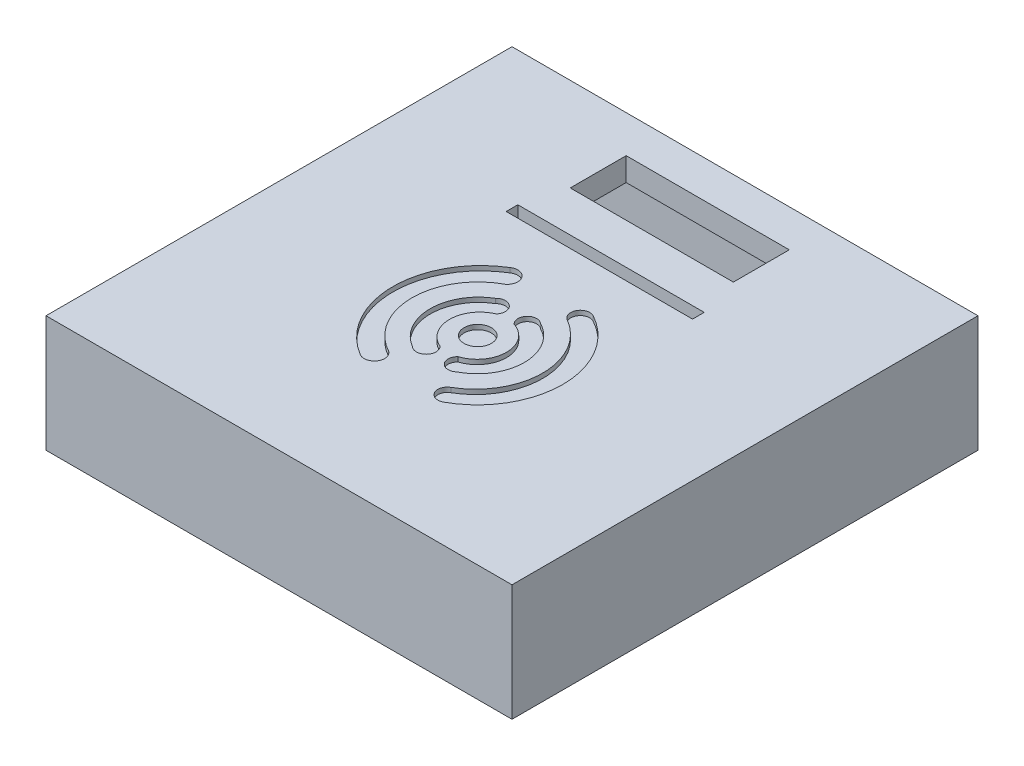
from build123d import *

# Parameters (mm, degrees)
ESQUISSE1_W              = 200
ESQUISSE1_H              = 200
BOSS_EXTRU_1_DEPTH       = 50
ESQUISSE2_W              = 190
ESQUISSE2_H              = 190
ENL_V_MAT_EXTRU_1_DEPTH  = 40
ESQUISSE3_W              = 70
ESQUISSE3_H              = 24
ENL_V_MAT_EXTRU_2_DEPTH  = 10
ESQUISSE5_W              = 5
ESQUISSE5_H              = 18
ESQUISSE5_W_2            = 30
ESQUISSE5_H_2            = 14
ENL_V_MAT_EXTRU_3_DEPTH  = 6
ESQUISSE7_W              = 5
ESQUISSE7_H              = 14
ENL_V_MAT_EXTRU_5_DEPTH  = 6
ESQUISSE8_W              = 80
ESQUISSE8_H              = 5
ENL_V_MAT_EXTRU_6_DEPTH  = 10
ESQUISSE9_W              = 190
ESQUISSE9_H              = 5
BOSS_EXTRU_2_DEPTH       = 75
ESQUISSE11_W             = 50
ESQUISSE11_H             = 40
ESQUISSE11_W_2           = 40
ESQUISSE11_H_2           = 30
ENL_V_MAT_EXTRU_9_DEPTH  = 6
ESQUISSE12_R             = 5.86708194
ENL_V_MAT_EXTRU_10_DEPTH = 2
ESQUISSE13_W             = 20
ESQUISSE13_H             = 10
ENL_V_MAT_EXTRU_11_DEPTH = 5


with BuildPart() as part:
    # Esquisse1 → Boss.-Extru.1 (new body)
    with BuildSketch(Plane(origin=(0, 0, 0), x_dir=(1, 0, 0), z_dir=(0, 1, 0))):
        Rectangle(ESQUISSE1_W, ESQUISSE1_H)
    extrude(amount=BOSS_EXTRU_1_DEPTH)

    # Esquisse2 → Enlèv. mat.-Extru.1 (cut)
    with BuildSketch(Plane.XZ):
        Rectangle(ESQUISSE2_W, ESQUISSE2_H)
    extrude(amount=-ENL_V_MAT_EXTRU_1_DEPTH, mode=Mode.SUBTRACT)

    # Esquisse3 → Enlèv. mat.-Extru.2 (cut)
    with BuildSketch(Plane(origin=(0, 50, 0), x_dir=(1, 0, 0), z_dir=(0, 1, 0))):
        with Locations((0, 72)):
            Rectangle(ESQUISSE3_W, ESQUISSE3_H)
    extrude(amount=-ENL_V_MAT_EXTRU_2_DEPTH, mode=Mode.SUBTRACT)

    # Esquisse5 → Enlèv. mat.-Extru.3 (cut)
    with BuildSketch(Plane.XZ.offset(-40)):
        with Locations((37.5, -72)):
            Rectangle(ESQUISSE5_W, ESQUISSE5_H)
        with Locations((-20, -53)):
            Rectangle(ESQUISSE5_W_2, ESQUISSE5_H_2)
    extrude(amount=-ENL_V_MAT_EXTRU_3_DEPTH, mode=Mode.SUBTRACT)

    # Esquisse7 → Enlèv. mat.-Extru.5 (cut)
    with BuildSketch(Plane.XZ.offset(-40)):
        with Locations((-37.5, -53)):
            Rectangle(ESQUISSE7_W, ESQUISSE7_H)
    extrude(amount=-ENL_V_MAT_EXTRU_5_DEPTH, mode=Mode.SUBTRACT)

    # Esquisse8 → Enlèv. mat.-Extru.6 (cut)
    with BuildSketch(Plane.XZ.offset(-40)):
        with Locations((0, -40)):
            Rectangle(ESQUISSE8_W, ESQUISSE8_H)
    extrude(amount=-ENL_V_MAT_EXTRU_6_DEPTH, mode=Mode.SUBTRACT)

    # Esquisse9 → Boss.-Extru.2 (add)
    with BuildSketch(Plane(origin=(0, 0, 95), x_dir=(-1, 0, 0), z_dir=(0, 0, -1))):
        with Locations((0, 2.5)):
            Rectangle(ESQUISSE9_W, ESQUISSE9_H)
    extrude(amount=BOSS_EXTRU_2_DEPTH)

    # Esquisse11 → Enlèv. mat.-Extru.9 (cut)
    with BuildSketch(Plane.XZ.offset(-40)):
        with Locations((0, 16)):
            Rectangle(ESQUISSE11_W, ESQUISSE11_H)
        with Locations((0, 16)):
            Rectangle(ESQUISSE11_W_2, ESQUISSE11_H_2, mode=Mode.SUBTRACT)
    extrude(amount=-ENL_V_MAT_EXTRU_9_DEPTH, mode=Mode.SUBTRACT)

    # Esquisse12 → Enlèv. mat.-Extru.10 (cut)
    with BuildSketch(Plane(origin=(0, 50, 0), x_dir=(1, 0, 0), z_dir=(0, 1, 0))):
        with Locations(Location((0, -14.714419725, 0), (0, 0, 270))):
            Circle(ESQUISSE12_R)
        with BuildLine():
            ThreePointArc((3.657276348, -2.723473664), (12.412554836, -14.744243454), (3.657276348, -26.765013245))
            ThreePointArc((3.657276348, -26.765013245), (3.359240733, -32.427689923), (9.021917411, -32.725725538))
            ThreePointArc((9.021917411, -32.725725538), (20.02990103, -14.744243454), (9.021917411, 3.237238629))
            ThreePointArc((9.021917411, 3.237238629), (3.359240733, 2.939203014), (3.657276348, -2.723473664))
        make_face()
        with BuildLine():
            ThreePointArc((-4.091649632, -2.723473664), (-12.057804345, -14.744243454), (-4.091649632, -26.765013245))
            ThreePointArc((-4.091649632, -26.765013245), (-4.087653986, -32.721729891), (-10.044370632, -32.725725538))
            ThreePointArc((-10.044370632, -32.725725538), (-20.198964068, -14.893261262), (-10.044370632, 2.939203014))
            ThreePointArc((-10.044370632, 2.939203014), (-4.236671793, 3.084225175), (-4.091649632, -2.723473664))
        make_face()
        with BuildLine():
            ThreePointArc((13.591796836, 10.19140297), (11.86542759, 15.688813034), (17.349999414, 17.455544504))
            ThreePointArc((17.349999414, 17.455544504), (36.455816795, -14.649786555), (17.402535548, -46.786323611))
            ThreePointArc((17.402535548, -46.786323611), (11.917488852, -45.152665208), (13.591796836, -39.679889879))
            ThreePointArc((13.591796836, -39.679889879), (27.918200585, -14.744243454), (13.591796836, 10.19140297))
        make_face()
        with BuildLine():
            ThreePointArc((-13.231408481, -39.679889879), (-12.247030277, -45.830218737), (-18.397359135, -46.814596942))
            ThreePointArc((-18.397359135, -46.814596942), (-36.414367356, -14.679352885), (-18.397359135, 17.455891172))
            ThreePointArc((-18.397359135, 17.455891172), (-12.182139707, 16.406622398), (-13.231408481, 10.19140297))
            ThreePointArc((-13.231408481, 10.19140297), (-28.157745811, -14.744243454), (-13.231408481, -39.679889879))
        make_face()
    extrude(amount=-ENL_V_MAT_EXTRU_10_DEPTH, mode=Mode.SUBTRACT)

    # Esquisse13 → Enlèv. mat.-Extru.11 (cut)
    with BuildSketch(Plane(origin=(-95, 0, 0), x_dir=(0, 0, -1), z_dir=(1, 0, 0))):
        with Locations((-30, 10)):
            Rectangle(ESQUISSE13_W, ESQUISSE13_H)
    extrude(amount=-ENL_V_MAT_EXTRU_11_DEPTH, mode=Mode.SUBTRACT)


solid = part.part
